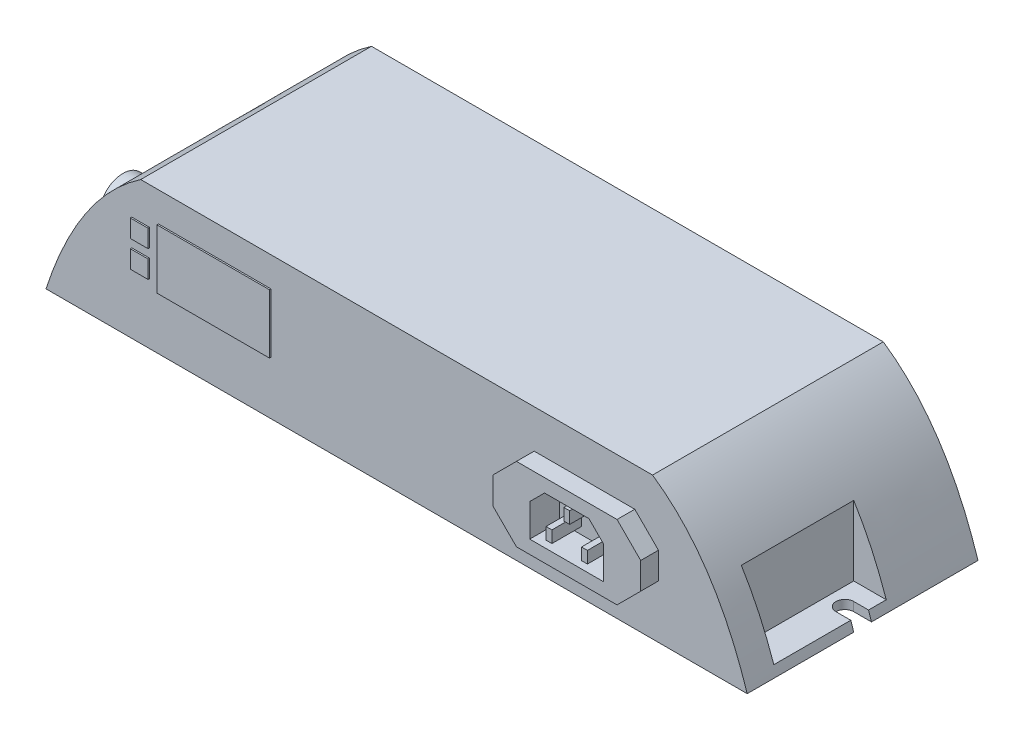
from build123d import *

# Parameters (mm, degrees)
SKETCH1_W           = 237
SKETCH1_H           = 78
BOSS_EXTRUDE1_DEPTH = 48
SKETCH2_W           = 38
SKETCH2_H           = 30
CUT_EXTRUDE1_DEPTH  = 12
CUT_EXTRUDE2_DEPTH  = 150.767319533
SKETCH4_R           = 8
BOSS_EXTRUDE2_DEPTH = 10
BOSS_EXTRUDE3_DEPTH = 6
CUT_EXTRUDE3_DEPTH  = 10
SKETCH7_W           = 2
SKETCH7_H           = 4
BOSS_EXTRUDE4_DEPTH = 10
SKETCH8_W           = 38
SKETCH8_H           = 20
SKETCH8_W_2         = 6
SKETCH8_H_2         = 6
BOSS_EXTRUDE5_DEPTH = 0.5
CUT_EXTRUDE4_DEPTH  = 136.540584451


with BuildPart() as part:
    # Sketch1 → Boss-Extrude1 (new body)
    with BuildSketch(Plane(origin=(0, 0, 0), x_dir=(1, 0, 0), z_dir=(0, 1, 0))):
        Rectangle(SKETCH1_W, SKETCH1_H)
    extrude(amount=BOSS_EXTRUDE1_DEPTH)

    # Sketch2 → Cut-Extrude1 (cut)
    with BuildSketch(Plane(origin=(118.5, 0, 0), x_dir=(0, 0, -1), z_dir=(1, 0, 0))):
        with Locations((-10, 18)):
            Rectangle(SKETCH2_W, SKETCH2_H)
    cut_extrude1 = extrude(amount=-CUT_EXTRUDE1_DEPTH, mode=Mode.SUBTRACT)

    # Sketch3 → Cut-Extrude2 (cut, through all)
    with BuildSketch(Plane.XY.offset(39)):
        with BuildLine():
            Line((118.5, 0), (133.818434768, 0))
            Line((133.818434768, 0), (133.818434768, 98.676655982))
            Line((133.818434768, 98.676655982), (0, 98.676655982))
            Line((0, 98.676655982), (0, 48))
            add(Edge.make_bspline(
                [(118.5, 0), (91.353626717, 83.98617523), (0, 48)],
                knots=[0, 0, 0, 1, 1, 1], degree=2))
        make_face()
    cut_extrude2 = extrude(amount=-CUT_EXTRUDE2_DEPTH, mode=Mode.SUBTRACT)

    # Mirror1: Cut-Extrude1, Cut-Extrude2 across plane
    add(cut_extrude1.mirror(Plane(origin=(0, 0, 0), x_dir=(0, 0, 1), z_dir=(1, 0, 0))), mode=Mode.SUBTRACT)
    add(cut_extrude2.mirror(Plane(origin=(0, 0, 0), x_dir=(0, 0, 1), z_dir=(1, 0, 0))), mode=Mode.SUBTRACT)

    # Sketch4 → Boss-Extrude2 (add)
    with BuildSketch(Plane(origin=(-106.5, 0, 0), x_dir=(0, 0, -1), z_dir=(1, 0, 0))):
        with Locations((-15, 14.792033804)):
            Circle(SKETCH4_R)
    extrude(amount=-BOSS_EXTRUDE2_DEPTH)

    # Sketch5 → Boss-Extrude3 (add)
    with BuildSketch(Plane.XY.offset(39)):
        Polygon((46.5, 35), (38.5, 27), (38.5, 18), (46.5, 10), (80.5, 10), (88.5, 18), (88.5, 27), (80.5, 35), align=None)
    extrude(amount=BOSS_EXTRUDE3_DEPTH)

    # Sketch6 → Cut-Extrude3 (cut)
    with BuildSketch(Plane.XY.offset(45)):
        Polygon((51, 25.5), (56, 30.5), (71, 30.5), (76, 25.5), (76, 14.5), (51, 14.5), align=None)
    extrude(amount=-CUT_EXTRUDE3_DEPTH, mode=Mode.SUBTRACT)

    # Sketch7 → Boss-Extrude4 (add)
    with BuildSketch(Plane.XY.offset(35)):
        with Locations((63.5, 27.549695856)):
            Rectangle(SKETCH7_W, SKETCH7_H)
        with Locations((57.5, 18.950949538)):
            Rectangle(SKETCH7_W, SKETCH7_H)
        with Locations((69.5, 18.950949538)):
            Rectangle(SKETCH7_W, SKETCH7_H)
    extrude(amount=BOSS_EXTRUDE4_DEPTH)

    # Sketch8 → Boss-Extrude5 (add)
    with BuildSketch(Plane.XY.offset(39)):
        with Locations((-61.5, 28)):
            Rectangle(SKETCH8_W, SKETCH8_H)
        with Locations((-86.5, 23.5)):
            Rectangle(SKETCH8_W_2, SKETCH8_H_2)
        with Locations((-86.5, 32.5)):
            Rectangle(SKETCH8_W_2, SKETCH8_H_2)
    extrude(amount=BOSS_EXTRUDE5_DEPTH)

    # Sketch9 → Cut-Extrude4 (cut, through all)
    with BuildSketch(Plane.XZ):
        with BuildLine():
            Line((-112.5, -3), (-118.5, -3))
            Line((-118.5, -3), (-118.5, 3))
            Line((-118.5, 3), (-112.5, 3))
            ThreePointArc((-112.5, 3), (-109.5, 0), (-112.5, -3))
        make_face()
        with BuildLine():
            Line((118.5, 3), (118.5, -3))
            Line((118.5, -3), (112.5, -3))
            ThreePointArc((112.5, -3), (109.5, 0), (112.5, 3))
            Line((112.5, 3), (118.5, 3))
        make_face()
    extrude(amount=-CUT_EXTRUDE4_DEPTH, mode=Mode.SUBTRACT)


solid = part.part
